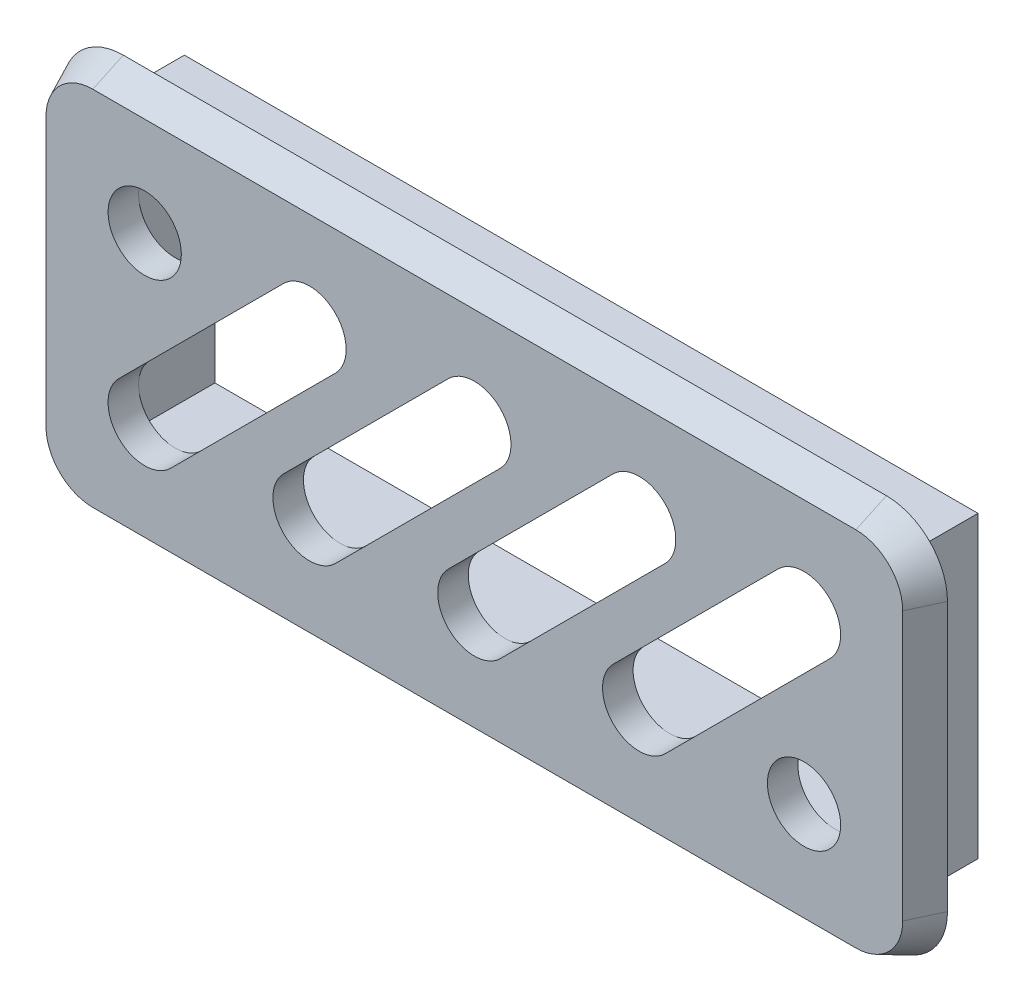
from build123d import *

# Parameters (mm, degrees)
SKETCH_1_W          = 26
SKETCH_1_H          = 9.8
SKETCH_1_W_2        = 24
SKETCH_1_H_2        = 7.8
EXTRUDE_1_DEPTH     = 2.5
EXTRUDE_2_DEPTH     = 1
EXTRUDE_2_TAPER     = 25
CUT_EXTRUDE_1_REACH = 40.157
SKETCH_3_R          = 1.2


with BuildPart() as part:
    # 草图1 → 凸台-拉伸1 (new body)
    with BuildSketch(Plane.XY):
        with Locations((20.66383505, -8.200793938)):
            Rectangle(SKETCH_1_W, SKETCH_1_H)
        with Locations((20.66383505, -8.200793938)):
            Rectangle(SKETCH_1_W_2, SKETCH_1_H_2, mode=Mode.SUBTRACT)
    extrude(amount=-EXTRUDE_1_DEPTH)

    # 草图2 → 凸台-拉伸2 (add)
    with BuildSketch(Plane.XY):
        with BuildLine():
            Line((35.16383505, -12.600793938), (35.16383505, -3.800793938))
            ThreePointArc((35.16383505, -3.800793938), (34.578048612, -2.386580376), (33.16383505, -1.800793938))
            Line((33.16383505, -1.800793938), (8.16383505, -1.800793938))
            ThreePointArc((8.16383505, -1.800793938), (6.749621488, -2.386580376), (6.16383505, -3.800793938))
            Line((6.16383505, -3.800793938), (6.16383505, -12.600793938))
            ThreePointArc((6.16383505, -12.600793938), (6.749621488, -14.015007501), (8.16383505, -14.600793938))
            Line((8.16383505, -14.600793938), (33.16383505, -14.600793938))
            ThreePointArc((33.16383505, -14.600793938), (34.578048612, -14.015007501), (35.16383505, -12.600793938))
        make_face()
    extrude(amount=EXTRUDE_2_DEPTH, taper=EXTRUDE_2_TAPER)

    # 草图3 → 切除-拉伸1 (cut, up to next)
    with BuildSketch(Plane(origin=(0, 0, 0), x_dir=(-1, 0, 0), z_dir=(0, 0, -1)), mode=Mode.PRIVATE) as cut_extrude_1_sk1:
        with Locations(Location((-31.46383505, -10.900793938, 0), (0, 0, 180))):
            Circle(SKETCH_3_R)
    cut_extrude_1_tool1 = extrude(cut_extrude_1_sk1.sketch, amount=-CUT_EXTRUDE_1_REACH, mode=Mode.PRIVATE) & part.part
    # 草图3 → 切除-拉伸1 (cut, up to next)
    with BuildSketch(Plane(origin=(0, 0, 0), x_dir=(-1, 0, 0), z_dir=(0, 0, -1)), mode=Mode.PRIVATE) as cut_extrude_1_sk2:
        with Locations((-9.86383505, -5.500793938)):
            Circle(SKETCH_3_R)
    cut_extrude_1_tool2 = extrude(cut_extrude_1_sk2.sketch, amount=-CUT_EXTRUDE_1_REACH, mode=Mode.PRIVATE) & part.part
    # 草图3 → 切除-拉伸1 (cut, up to next)
    with BuildSketch(Plane(origin=(0, 0, 0), x_dir=(-1, 0, 0), z_dir=(0, 0, -1)), mode=Mode.PRIVATE) as cut_extrude_1_sk3:
        with BuildLine():
            Line((-30.615306913, -4.652265801), (-25.215306913, -10.052265801))
            ThreePointArc((-25.215306913, -10.052265801), (-25.215306913, -11.749322076), (-26.912363188, -11.749322076))
            Line((-26.912363188, -11.749322076), (-32.312363188, -6.349322076))
            ThreePointArc((-32.312363188, -6.349322076), (-32.312363188, -4.652265801), (-30.615306913, -4.652265801))
        make_face()
    cut_extrude_1_tool3 = extrude(cut_extrude_1_sk3.sketch, amount=-CUT_EXTRUDE_1_REACH, mode=Mode.PRIVATE) & part.part
    # 草图3 → 切除-拉伸1 (cut, up to next)
    with BuildSketch(Plane(origin=(0, 0, 0), x_dir=(-1, 0, 0), z_dir=(0, 0, -1)), mode=Mode.PRIVATE) as cut_extrude_1_sk4:
        with BuildLine():
            Line((-25.215306913, -4.652265801), (-19.815306913, -10.052265801))
            ThreePointArc((-19.815306913, -10.052265801), (-19.815306913, -11.749322076), (-21.512363188, -11.749322076))
            Line((-21.512363188, -11.749322076), (-26.912363188, -6.349322076))
            ThreePointArc((-26.912363188, -6.349322076), (-26.912363188, -4.652265801), (-25.215306913, -4.652265801))
        make_face()
    cut_extrude_1_tool4 = extrude(cut_extrude_1_sk4.sketch, amount=-CUT_EXTRUDE_1_REACH, mode=Mode.PRIVATE) & part.part
    # 草图3 → 切除-拉伸1 (cut, up to next)
    with BuildSketch(Plane(origin=(0, 0, 0), x_dir=(-1, 0, 0), z_dir=(0, 0, -1)), mode=Mode.PRIVATE) as cut_extrude_1_sk5:
        with BuildLine():
            Line((-19.815306913, -4.652265801), (-14.415306913, -10.052265801))
            ThreePointArc((-14.415306913, -10.052265801), (-14.415306913, -11.749322076), (-16.112363188, -11.749322076))
            Line((-16.112363188, -11.749322076), (-21.512363188, -6.349322076))
            ThreePointArc((-21.512363188, -6.349322076), (-21.512363188, -4.652265801), (-19.815306913, -4.652265801))
        make_face()
    cut_extrude_1_tool5 = extrude(cut_extrude_1_sk5.sketch, amount=-CUT_EXTRUDE_1_REACH, mode=Mode.PRIVATE) & part.part
    # 草图3 → 切除-拉伸1 (cut, up to next)
    with BuildSketch(Plane(origin=(0, 0, 0), x_dir=(-1, 0, 0), z_dir=(0, 0, -1)), mode=Mode.PRIVATE) as cut_extrude_1_sk6:
        with BuildLine():
            Line((-14.415306913, -4.652265801), (-9.015306913, -10.052265801))
            ThreePointArc((-9.015306913, -10.052265801), (-9.015306913, -11.749322076), (-10.712363188, -11.749322076))
            Line((-10.712363188, -11.749322076), (-16.112363188, -6.349322076))
            ThreePointArc((-16.112363188, -6.349322076), (-16.112363188, -4.652265801), (-14.415306913, -4.652265801))
        make_face()
    cut_extrude_1_tool6 = extrude(cut_extrude_1_sk6.sketch, amount=-CUT_EXTRUDE_1_REACH, mode=Mode.PRIVATE) & part.part
    add(cut_extrude_1_tool1.solids().sort_by_distance((31.463835, -10.900794, 0))[0], mode=Mode.SUBTRACT)
    add(cut_extrude_1_tool2.solids().sort_by_distance((9.863835, -5.500794, 0))[0], mode=Mode.SUBTRACT)
    add(cut_extrude_1_tool3.solids().sort_by_distance((28.763835, -8.200794, 0))[0], mode=Mode.SUBTRACT)
    add(cut_extrude_1_tool4.solids().sort_by_distance((23.363835, -8.200794, 0))[0], mode=Mode.SUBTRACT)
    add(cut_extrude_1_tool5.solids().sort_by_distance((17.963835, -8.200794, 0))[0], mode=Mode.SUBTRACT)
    add(cut_extrude_1_tool6.solids().sort_by_distance((12.563835, -8.200794, 0))[0], mode=Mode.SUBTRACT)


solid = part.part
